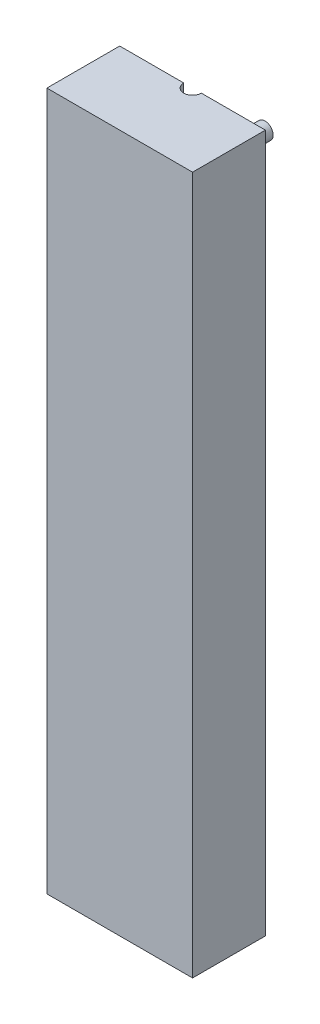
from build123d import *

# Parameters (mm, degrees)
SKETCH1_R            = 12.5
BOSS_EXTRUDE1_DEPTH  = 150.5
BOSS_EXTRUDE2_DEPTH  = 148.5
SKETCH8_R            = 12.5
CUT_EXTRUDE2_DEPTH   = 152.706130397
BOSS_EXTRUDE7_DEPTH  = 8
BOSS_EXTRUDE8_START  = -121
BOSS_EXTRUDE8_DEPTH  = 121
BOSS_EXTRUDE9_DEPTH  = 148.5
SKETCH13_R           = 1.75
CUT_EXTRUDE3_DEPTH   = 3.5
SKETCH14_R           = 1.75
BOSS_EXTRUDE10_DEPTH = 3.4
SKETCH15_R           = 1.75
CUT_EXTRUDE4_DEPTH   = 3.5
SKETCH16_R           = 1.75
BOSS_EXTRUDE11_DEPTH = 3.4


with BuildPart() as part:
    # Sketch1 → Boss-Extrude1 (new body)
    with BuildSketch(Plane(origin=(0, 0, 0), x_dir=(1, 0, 0), z_dir=(0, 1, 0))):
        with Locations(Location((0, 0, 0), (0, 0, 270))):
            Circle(SKETCH1_R)
    extrude(amount=BOSS_EXTRUDE1_DEPTH)

    # Sketch2 → Boss-Extrude2 (add)
    with BuildSketch(Plane(origin=(0, 150.5, 0), x_dir=(1, 0, 0), z_dir=(0, 1, 0))):
        with BuildLine():
            Line((-13.5, 0), (13.5, 0))
            ThreePointArc((13.5, 0), (0, -13.5), (-13.5, 0))
        make_face()
    extrude(amount=-BOSS_EXTRUDE2_DEPTH)

    # Sketch8 → Cut-Extrude2 (cut, through all)
    with BuildSketch(Plane(origin=(0, 150.5, 0), x_dir=(1, 0, 0), z_dir=(0, 1, 0))):
        Circle(SKETCH8_R)
    extrude(amount=-CUT_EXTRUDE2_DEPTH, mode=Mode.SUBTRACT)

    # Sketch9 → Boss-Extrude7 (add)
    with BuildSketch(Plane(origin=(0, 150.5, 0), x_dir=(1, 0, 0), z_dir=(0, 1, 0))):
        with BuildLine():
            Line((12.5, 0), (1.875, 0))
            ThreePointArc((1.875, 0), (0, -1.875), (-1.875, 0))
            Line((-1.875, 0), (-12.5, 0))
            ThreePointArc((-12.5, 0), (0, -12.5), (12.5, 0))
        make_face()
    extrude(amount=-BOSS_EXTRUDE7_DEPTH)

    # Sketch11 → Boss-Extrude8 (add)
    with BuildSketch(Plane.XZ.offset(-2).offset(BOSS_EXTRUDE8_START)):
        with BuildLine():
            Line((-12.5, 0), (-8, 0))
            ThreePointArc((-8, 0), (0, 8), (8, 0))
            Line((8, 0), (12.5, 0))
            ThreePointArc((12.5, 0), (0, 12.5), (-12.5, 0))
        make_face()
    extrude(amount=BOSS_EXTRUDE8_DEPTH)

    # Sketch12 → Boss-Extrude9 (add)
    with BuildSketch(Plane(origin=(0, 150.5, 0), x_dir=(1, 0, 0), z_dir=(0, 1, 0))):
        with BuildLine():
            Line((-13.5, 0), (-15.5, 0))
            Line((-15.5, 0), (-15.5, -15.5))
            Line((-15.5, -15.5), (15.5, -15.5))
            Line((15.5, -15.5), (15.5, 0))
            Line((15.5, 0), (13.5, 0))
            ThreePointArc((13.5, 0), (0, -13.5), (-13.5, 0))
        make_face()
    extrude(amount=-BOSS_EXTRUDE9_DEPTH)

    # Sketch13 → Cut-Extrude3 (cut)
    with BuildSketch(Plane(origin=(0, 0, 0), x_dir=(-1, 0, 0), z_dir=(0, 0, -1))):
        with Locations((12, 147)):
            Circle(SKETCH13_R)
    extrude(amount=-CUT_EXTRUDE3_DEPTH, mode=Mode.SUBTRACT)

    # Sketch14 → Boss-Extrude10 (add)
    with BuildSketch(Plane(origin=(0, 0, 0), x_dir=(-1, 0, 0), z_dir=(0, 0, -1))):
        with Locations((-12, 147)):
            Circle(SKETCH14_R)
    extrude(amount=BOSS_EXTRUDE10_DEPTH)

    # Sketch15 → Cut-Extrude4 (cut)
    with BuildSketch(Plane(origin=(0, 0, 0), x_dir=(-1, 0, 0), z_dir=(0, 0, -1))):
        with Locations((-12, 5.5)):
            Circle(SKETCH15_R)
    extrude(amount=-CUT_EXTRUDE4_DEPTH, mode=Mode.SUBTRACT)

    # Sketch16 → Boss-Extrude11 (add)
    with BuildSketch(Plane(origin=(0, 0, 0), x_dir=(-1, 0, 0), z_dir=(0, 0, -1))):
        with Locations((12, 5.5)):
            Circle(SKETCH16_R)
    extrude(amount=BOSS_EXTRUDE11_DEPTH)


solid = part.part
